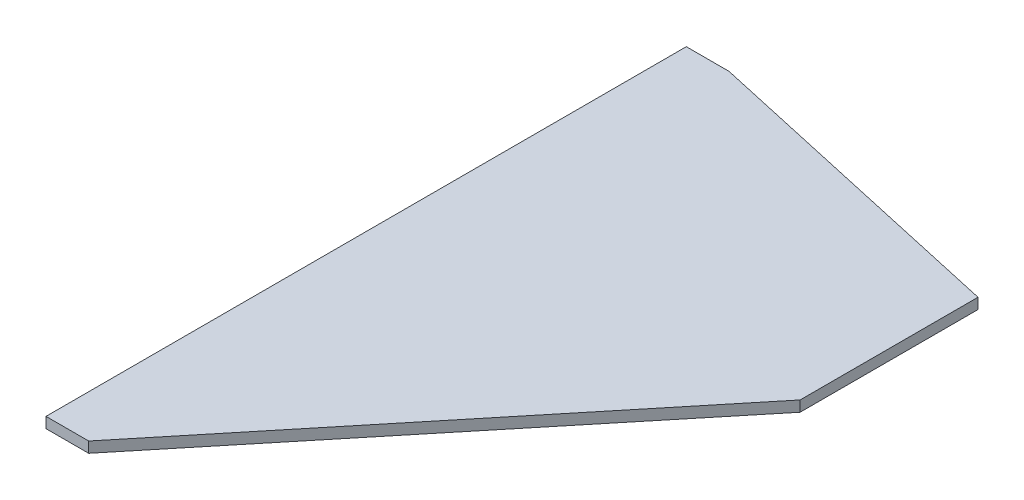
from build123d import *

# Parameters (mm, degrees)
BOSS_EXTRUDE1_DEPTH = 3


with BuildPart() as part:
    # Sketch1 → Boss-Extrude1 (new body)
    with BuildSketch(Plane(origin=(0, 0, 0), x_dir=(1, 0, 0), z_dir=(0, 1, 0))):
        Polygon((12, 0), (102, 110), (102, 160), (12, 180), (0, 180), (0, 0), align=None)
    extrude(amount=BOSS_EXTRUDE1_DEPTH)


solid = part.part
